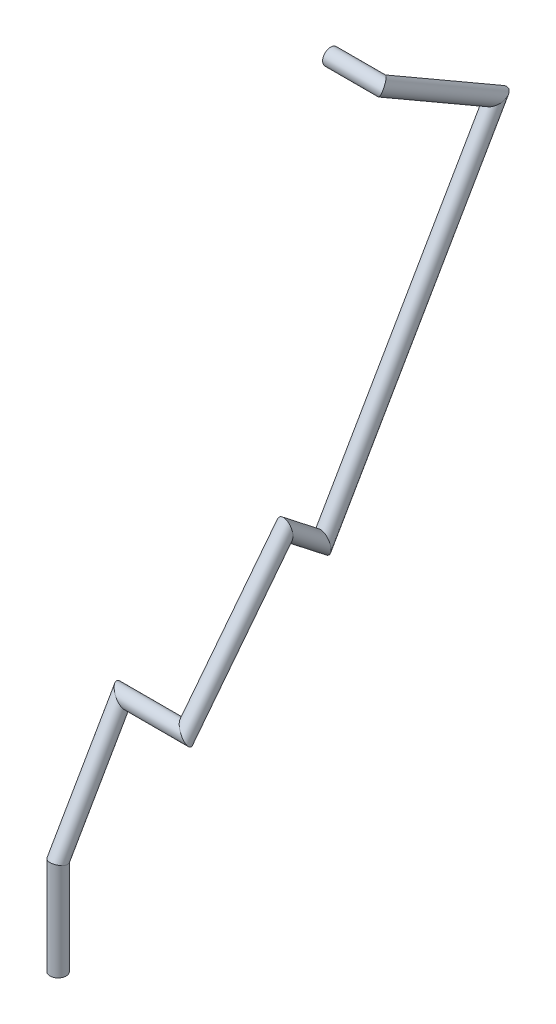
from build123d import *

# Parameters (mm, degrees)
SWEEP1_PROFILE_R = 2.5


with BuildPart() as part:
    # Sweep1: sweep along a curve in space
    with BuildLine() as sweep1_path:
        Line((0, 0, 0), (0, 30, 0))
        Line((0, 30, 0), (0, 64.641016151, -20))
        Line((0, 64.641016151, -20), (20, 64.641016151, -20))
        Line((20, 64.641016151, -20), (20, 104.041553832, -50.783073766))
        Line((20, 104.041553832, -50.783073766), (20, 94.806631702, -62.60323507))
        Line((20, 94.806631702, -62.60323507), (20, 188.337375311, -116.60323507))
        Line((20, 188.337375311, -116.60323507), (20, 208.837375311, -81.096193515))
        Line((20, 208.837375311, -81.096193515), (3.978461048, 208.837375311, -81.096193515))
    # Sweep1 profile (on start of the path) → Sweep1 (sweep)
    with BuildSketch(Plane.ZX):
        Circle(SWEEP1_PROFILE_R)
    sweep(path=sweep1_path.line, transition=Transition.RIGHT)


solid = part.part
